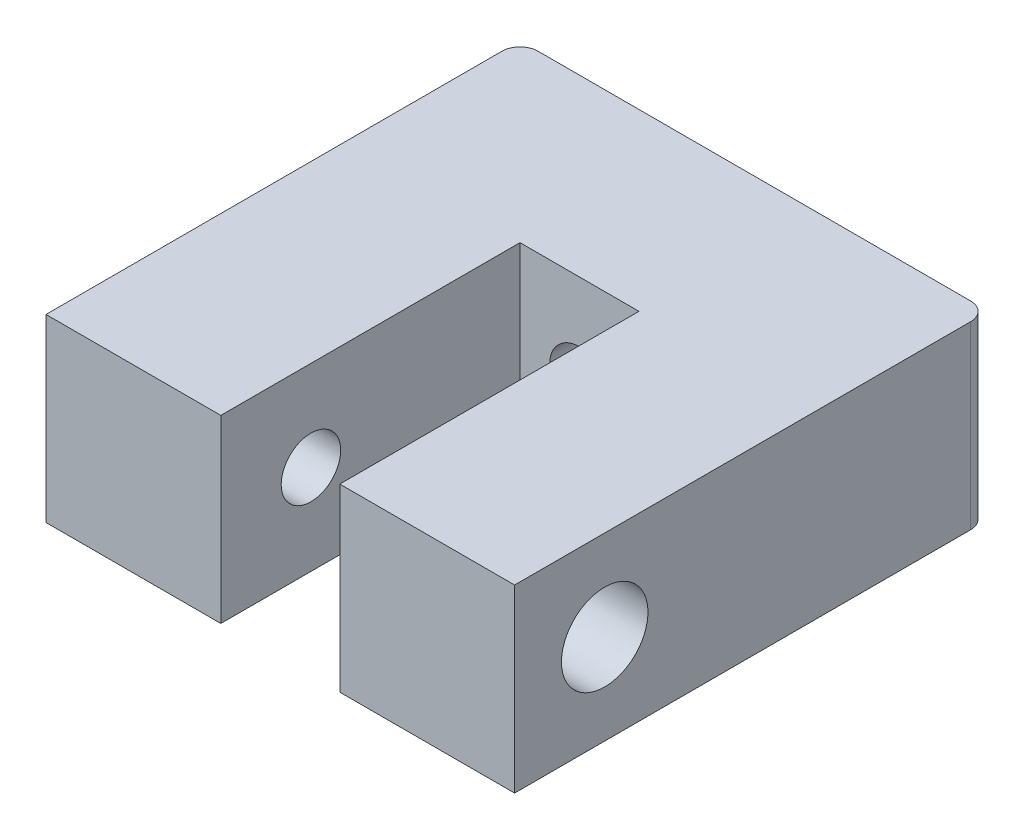
from build123d import *

# Parameters (mm, degrees)
BOSS_EXTRUDE1_DEPTH             = 10
TAP_DRILL_FOR_M4X0_7_TAP1_D     = 3.3
TAP_DRILL_FOR_M4X0_7_TAP1_DEPTH = 9.7
SKETCH5_W                       = 2.4
SKETCH5_H                       = 9.7
TAP_DRILL_FOR_M4X0_7_TAP2_D     = 3.3
FILLET1_R                       = 1


with BuildPart() as part:
    # Sketch1 → Boss-Extrude1 (new body)
    with BuildSketch(Plane(origin=(0, 0, 0), x_dir=(1, 0, 0), z_dir=(0, 1, 0))):
        Polygon((-3.3, 3.3), (-3.3, -13.3), (-13, -13.3), (-13, 13), (13, 13), (13, -13.3), (3.3, -13.3), (3.3, 3.3), align=None)
    extrude(amount=BOSS_EXTRUDE1_DEPTH)

    # Tap Drill for M4x0.7 Tap1
    with Locations(Plane(origin=(-13, 5, 8.3), x_dir=(0, 0, -1), z_dir=(-1, 0, 0))):
        with Locations((0, 0)):
            Hole(TAP_DRILL_FOR_M4X0_7_TAP1_D / 2, depth=TAP_DRILL_FOR_M4X0_7_TAP1_DEPTH)

    # Sketch5 → M4 Clearance Hole1 (revolve, cut)
    with BuildSketch(Plane(origin=(3.3, 5, 8.3), x_dir=(0, 0, 1), z_dir=(0, 1, 0))):
        with Locations((1.2, 4.85)):
            Rectangle(SKETCH5_W, SKETCH5_H)
    revolve(axis=Axis((-3.05, 5, 8.3), (1, 0, 0)), mode=Mode.SUBTRACT)

    # Tap Drill for M4x0.7 Tap2 (through all)
    with Locations(Plane(origin=(0, 5, -13), x_dir=(-1, 0, 0), z_dir=(0, 0, -1))):
        with Locations((0, 0)):
            Hole(TAP_DRILL_FOR_M4X0_7_TAP2_D / 2)

    # Fillet1
    fillet1_edges = [part.edges().sort_by_distance(p)[0] for p in [
        (-13, 5, -13),
        (13, 5, -13),
    ]]
    fillet(fillet1_edges, radius=FILLET1_R)


solid = part.part
